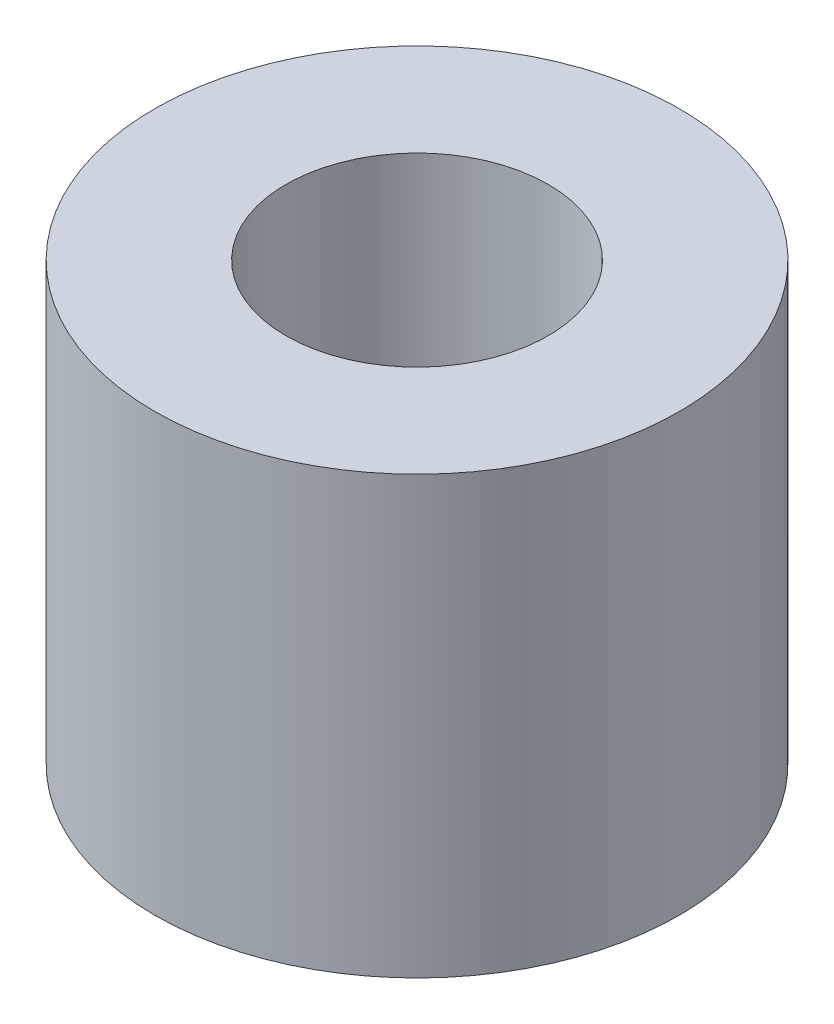
from build123d import *

# Parameters (mm, degrees)
SKETCH2_R           = 3
SKETCH2_R_2         = 1.5
BOSS_EXTRUDE1_DEPTH = 4.99


with BuildPart() as part:
    # Sketch2 → Boss-Extrude1 (new body)
    with BuildSketch(Plane(origin=(0, 0, 0), x_dir=(1, 0, 0), z_dir=(0, 1, 0))):
        with Locations(Location((0, -0.018523637, 0), (0, 0, 270))):
            Circle(SKETCH2_R)
        with Locations(Location((0, -0.018523637, 0), (0, 0, 270))):
            Circle(SKETCH2_R_2, mode=Mode.SUBTRACT)
    extrude(amount=BOSS_EXTRUDE1_DEPTH)


solid = part.part
